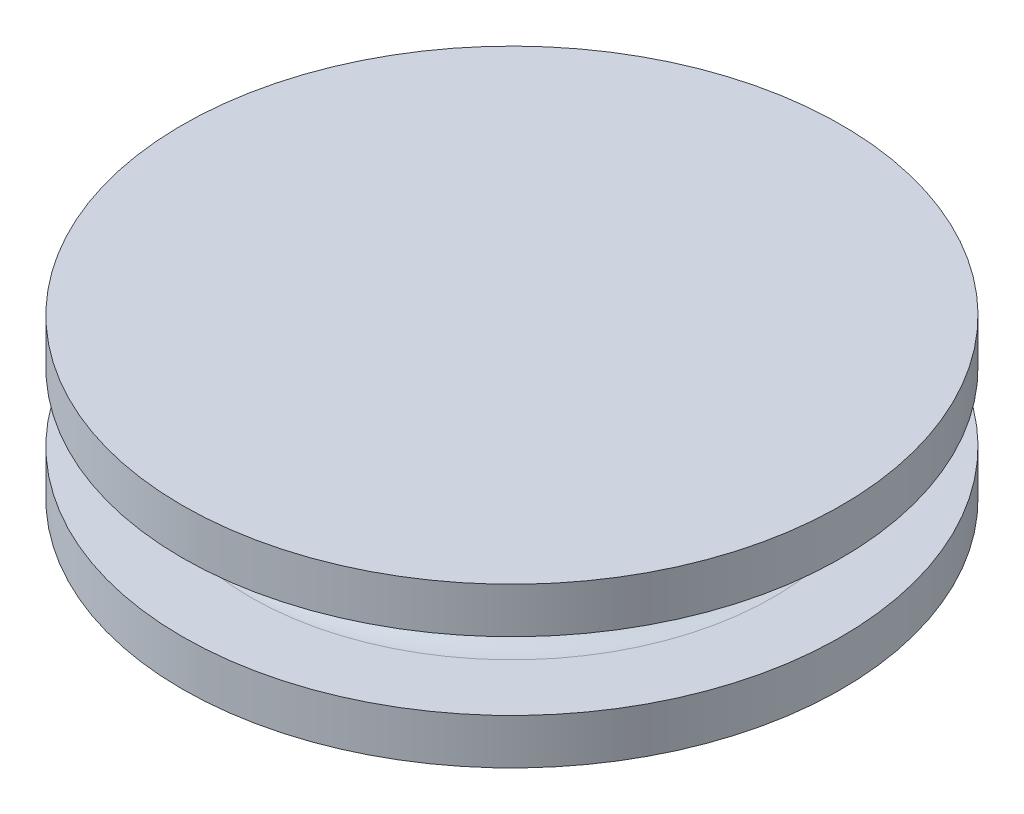
from build123d import *


with BuildPart() as part:
    # ｽｹｯﾁ1 → 回転1 (revolve)
    with BuildSketch(Plane.XY, mode=Mode.PRIVATE) as revolve_1_sk:
        with BuildLine():
            Line((0, 3.5), (-14.5, 3.5))
            Line((-14.5, 3.5), (-14.5, 1.5))
            Line((-14.5, 1.5), (-11.5, 1.5))
            ThreePointArc((-11.5, 1.5), (-10, 0), (-11.5, -1.5))
            Line((-11.5, -1.5), (-14.5, -1.5))
            Line((-14.5, -1.5), (-14.5, -3.5))
            Line((-14.5, -3.5), (0, -3.5))
            Line((0, -3.5), (0, 3.5))
        make_face()
    revolve(revolve_1_sk.sketch.rotate(Axis((0, 3.5, 0), (0, -1, 0)), 270), axis=Axis((0, 3.5, 0), (0, -1, 0)))


solid = part.part
